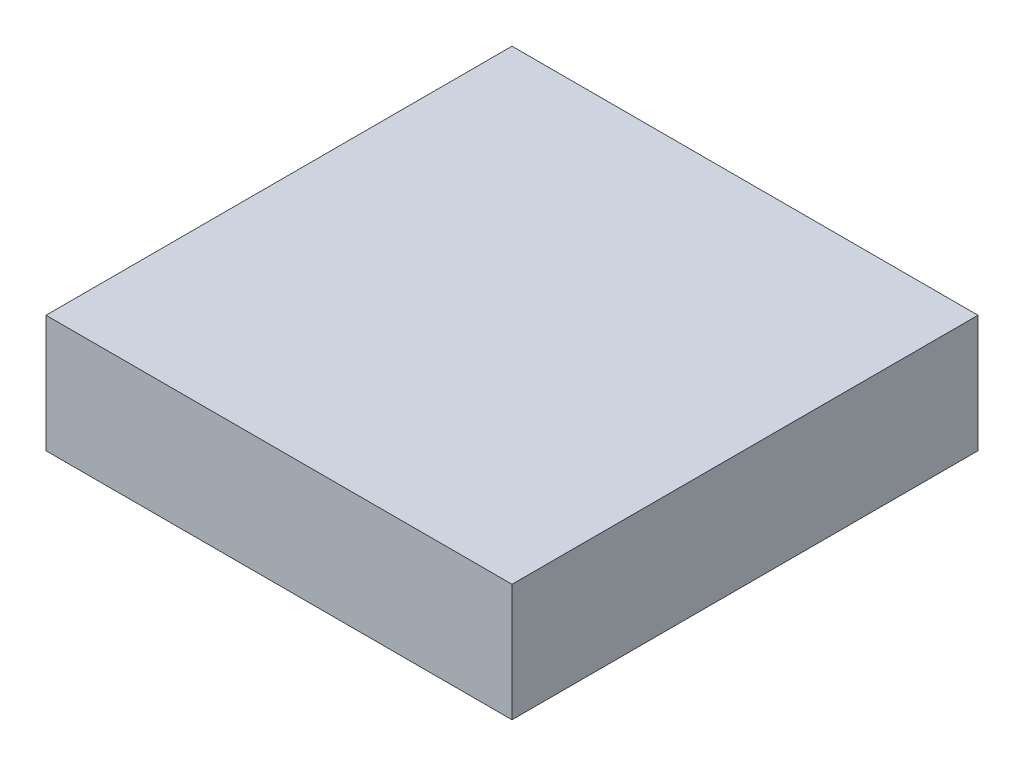
from build123d import *

# Parameters (mm, degrees)
SKETCH2_W           = 170.18
SKETCH2_H           = 170.18
BOSS_EXTRUDE1_DEPTH = 42.8625


with BuildPart() as part:
    # Sketch2 → Boss-Extrude1 (new body)
    with BuildSketch(Plane(origin=(0, 0, 0), x_dir=(1, 0, 0), z_dir=(0, 1, 0))):
        with Locations((85.09, 85.09)):
            Rectangle(SKETCH2_W, SKETCH2_H)
    extrude(amount=BOSS_EXTRUDE1_DEPTH)


solid = part.part
